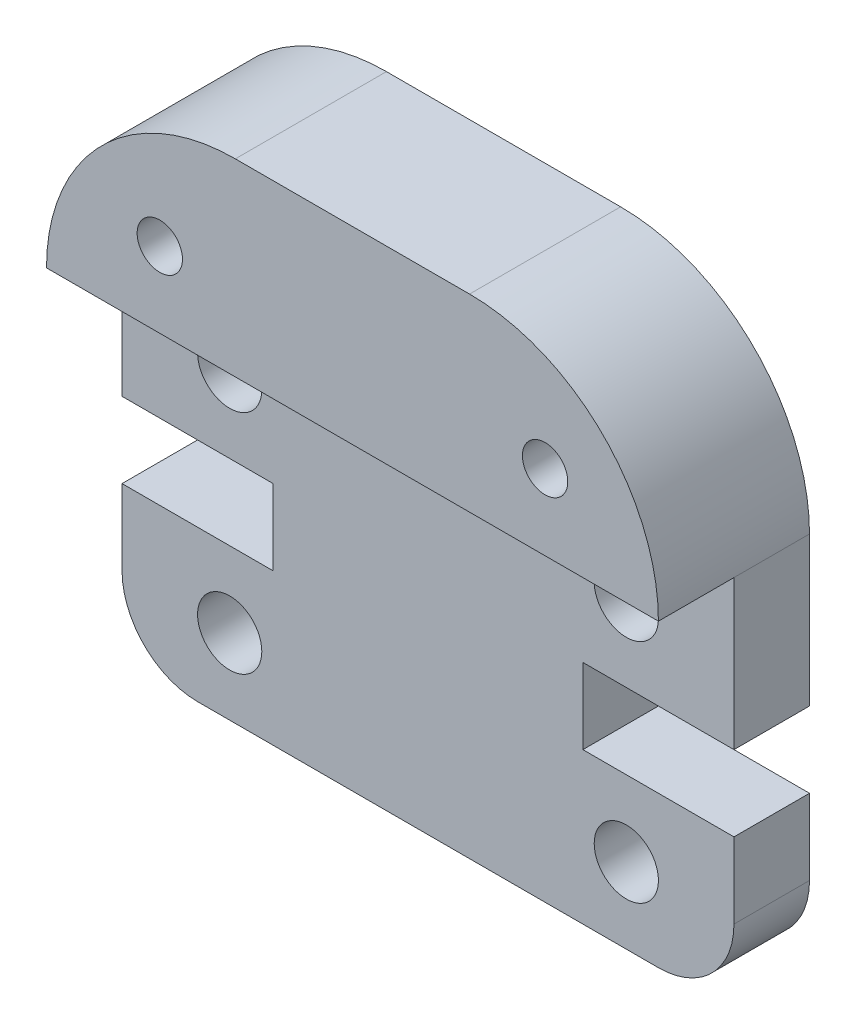
from build123d import *

# Parameters (mm, degrees)
SKETCH2_R           = 0.85
SKETCH2_R_2         = 0.6
BOSS_EXTRUDE1_DEPTH = 4
SKETCH3_W           = 16.2
SKETCH3_H           = 9.945
CUT_EXTRUDE2_DEPTH  = 2


with BuildPart() as part:
    # Sketch2 → Boss-Extrude1 (new body)
    with BuildSketch(Plane.XY):
        with BuildLine():
            Line((0, 9.945), (0, 6))
            Line((0, 6), (4, 6))
            Line((4, 6), (4, 4))
            Line((4, 4), (0, 4))
            Line((0, 4), (0, 2))
            ThreePointArc((0, 2), (0.585786438, 0.585786438), (2, 0))
            Line((2, 0), (14.2, 0))
            ThreePointArc((14.2, 0), (15.614213562, 0.585786438), (16.2, 2))
            Line((16.2, 2), (16.2, 4))
            Line((16.2, 4), (12.2, 4))
            Line((12.2, 4), (12.2, 6))
            Line((12.2, 6), (16.2, 6))
            Line((16.2, 6), (16.2, 9.945))
            ThreePointArc((16.2, 9.945), (14.735533906, 13.480533906), (11.2, 14.945))
            Line((11.2, 14.945), (5, 14.945))
            ThreePointArc((5, 14.945), (1.464466094, 13.480533906), (0, 9.945))
        make_face()
        with Locations((13.35, 8)):
            Circle(SKETCH2_R, mode=Mode.SUBTRACT)
        with Locations(Location((13.35, 2, 0), (0, 0, 180))):
            Circle(SKETCH2_R, mode=Mode.SUBTRACT)
        with Locations(Location((13.2, 11.942, 0), (0, 0, 180))):
            Circle(SKETCH2_R_2, mode=Mode.SUBTRACT)
        with Locations((3, 11.942)):
            Circle(SKETCH2_R_2, mode=Mode.SUBTRACT)
        with Locations((2.85, 2)):
            Circle(SKETCH2_R, mode=Mode.SUBTRACT)
        with Locations(Location((2.85, 8, 0), (0, 0, 180))):
            Circle(SKETCH2_R, mode=Mode.SUBTRACT)
    extrude(amount=BOSS_EXTRUDE1_DEPTH)

    # Sketch3 → Cut-Extrude2 (cut)
    with BuildSketch(Plane(origin=(0, 0, 4), x_dir=(-1, 0, 0), z_dir=(0, 0, -1))):
        with Locations((-8.1, 4.9725)):
            Rectangle(SKETCH3_W, SKETCH3_H)
    extrude(amount=CUT_EXTRUDE2_DEPTH, mode=Mode.SUBTRACT)


solid = part.part
